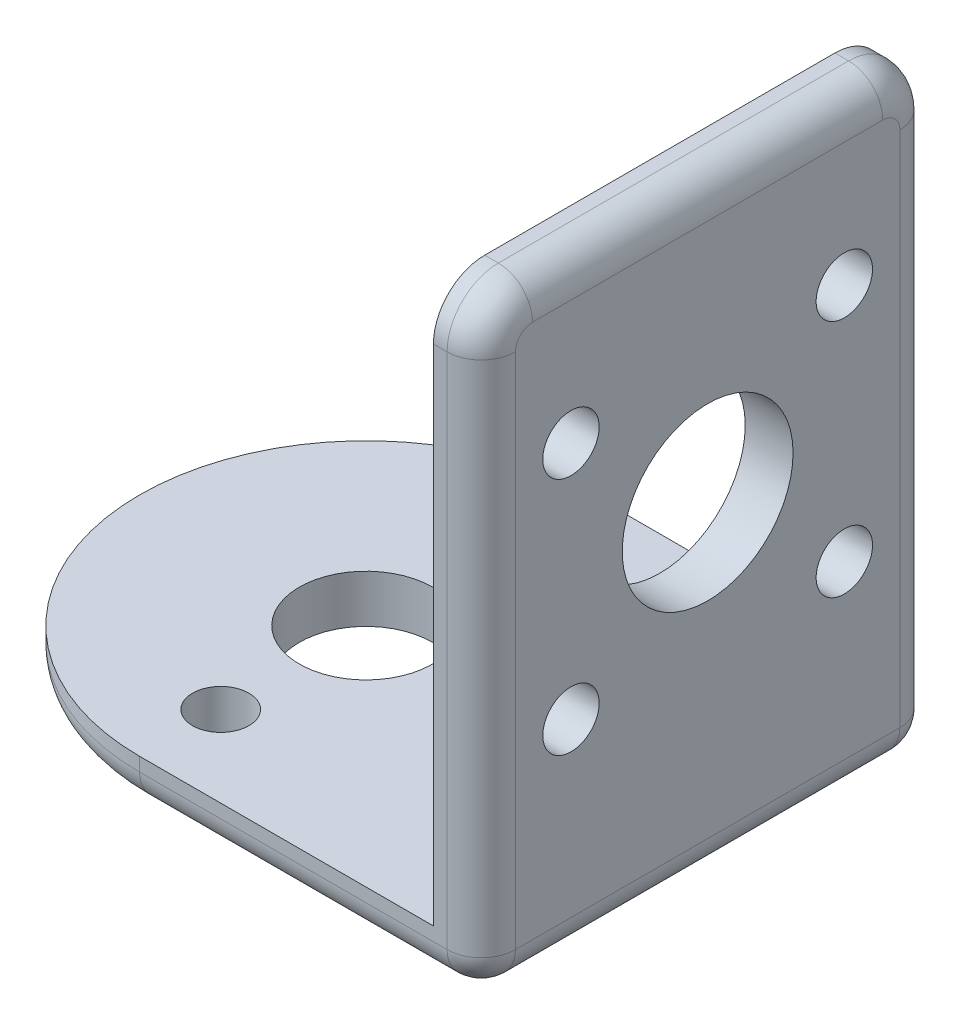
from build123d import *

# Parameters (mm, degrees)
SKETCH_1_W      = 26.5
SKETCH_1_H      = 32.5
SKETCH_1_R      = 5
SKETCH_1_R_2    = 1.65
EXTRUDE_1_DEPTH = 2.8
SKETCH_3_R      = 3.9
SKETCH_3_R_2    = 1.65
EXTRUDE_2_DEPTH = 2.8
FILLET_2_R      = 3
FILLET_3_R      = 3
FILLET_4_R      = 2
FILLET_5_R      = 2


with BuildPart() as part:
    # 草图1 → 凸台-拉伸1 (new body)
    with BuildSketch(Plane(origin=(0, 0, 0), x_dir=(0, 0, -1), z_dir=(1, 0, 0))):
        with Locations((13.25, -16.25)):
            Rectangle(SKETCH_1_W, SKETCH_1_H)
        with Locations((13.25, -16.25)):
            Circle(SKETCH_1_R, mode=Mode.SUBTRACT)
        with Locations((5.25, -9.25)):
            Circle(SKETCH_1_R_2, mode=Mode.SUBTRACT)
        with Locations((21.25, -9.25)):
            Circle(SKETCH_1_R_2, mode=Mode.SUBTRACT)
        with Locations((5.25, -23.25)):
            Circle(SKETCH_1_R_2, mode=Mode.SUBTRACT)
        with Locations((21.25, -23.25)):
            Circle(SKETCH_1_R_2, mode=Mode.SUBTRACT)
    extrude(amount=EXTRUDE_1_DEPTH)

    # 草图3 → 凸台-拉伸2 (add)
    with BuildSketch(Plane.XZ.offset(32.5)):
        with BuildLine():
            Line((2.8, 0), (-17.2, 0))
            ThreePointArc((-17.2, 0), (-30.45, -13.25), (-17.2, -26.5))
            Line((-17.2, -26.5), (2.8, -26.5))
            Line((2.8, -26.5), (2.8, 0))
        make_face()
        with Locations(Location((-17.2, -13.25, 0), (0, 0, 270))):
            Circle(SKETCH_3_R, mode=Mode.SUBTRACT)
        with Locations(Location((-17.2, -4.75, 0), (0, 0, 270))):
            Circle(SKETCH_3_R_2, mode=Mode.SUBTRACT)
        with Locations(Location((-17.2, -21.75, 0), (0, 0, 90))):
            Circle(SKETCH_3_R_2, mode=Mode.SUBTRACT)
    extrude(amount=EXTRUDE_2_DEPTH)

    # 圆角2
    fillet_2_edges = [part.edges().sort_by_distance(p)[0] for p in [
        (1.4, 0, -26.5),
    ]]
    fillet(fillet_2_edges, radius=FILLET_2_R)

    # 圆角3
    fillet_3_edges = [part.edges().sort_by_distance(p)[0] for p in [
        (1.4, 0, 0),
    ]]
    fillet(fillet_3_edges, radius=FILLET_3_R)

    # 圆角4
    fillet_4_edges = [part.edges().sort_by_distance(p)[0] for p in [
        (2.8, -35.3, -13.25),
    ]]
    fillet(fillet_4_edges, radius=FILLET_4_R)

    # 圆角5
    fillet_5_edges = [part.edges().sort_by_distance(p)[0] for p in [
        (-30.45, -35.3, -13.25),
        (-8.2, -35.3, -26.5),
        (2.8, 0, -13.25),
        (2.8, -0.878679656, -25.621320344),
        (2.8, -18.15, 0),
        (2.8, -0.878679656, -0.878679656),
        (-8.2, -35.3, 0),
        (2.214213562, -34.714213562, 0),
        (2.8, -18.15, -26.5),
        (2.214213562, -34.714213562, -26.5),
    ]]
    fillet(fillet_5_edges, radius=FILLET_5_R)


solid = part.part
